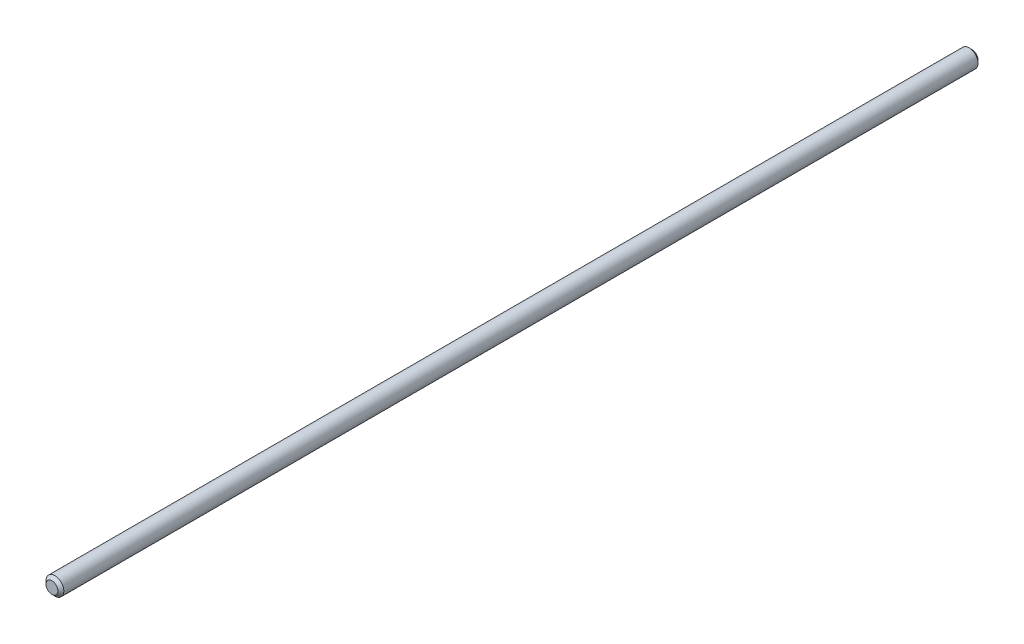
from build123d import *

# Parameters (mm, degrees)
SKETCH_1_R      = 1.5
EXTRUDE_1_DEPTH = 155
CHAMFER_1_SIZE  = 0.5


with BuildPart() as part:
    # Эскиз1 → Бобышка-Вытянуть1 (new body)
    with BuildSketch(Plane.XY):
        Circle(SKETCH_1_R)
    extrude(amount=EXTRUDE_1_DEPTH)

    # Фаска1
    chamfer_1_edges = [part.edges().sort_by_distance(p)[0] for p in [
        (-1.5, 0, 0),
        (-1.5, 0, 155),
    ]]
    chamfer(chamfer_1_edges, length=CHAMFER_1_SIZE)


solid = part.part
